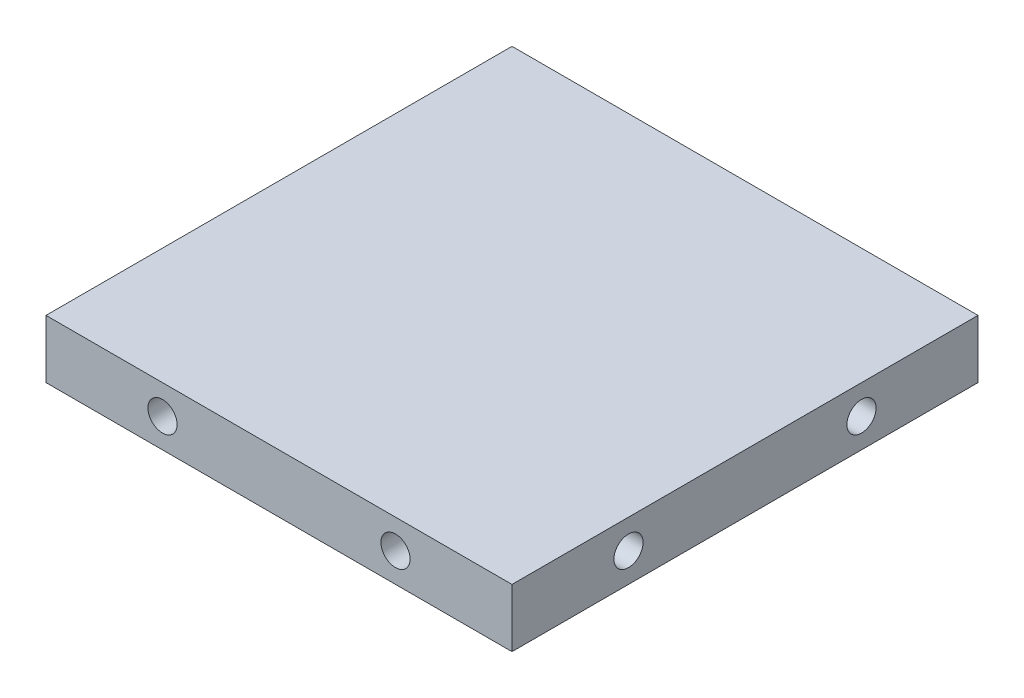
from build123d import *

# Parameters (mm, degrees)
SKETCH1_W           = 40
SKETCH1_H           = 40
BOSS_EXTRUDE1_DEPTH = 5
SKETCH2_R           = 1.25
CUT_EXTRUDE1_DEPTH  = 5
CIRPATTERN1_COUNT   = 4


with BuildPart() as part:
    # Sketch1 → Boss-Extrude1 (new body)
    with BuildSketch(Plane(origin=(0, 0, 0), x_dir=(1, 0, 0), z_dir=(0, 1, 0))):
        Rectangle(SKETCH1_W, SKETCH1_H)
    extrude(amount=BOSS_EXTRUDE1_DEPTH)

    # Sketch2 → Cut-Extrude1 (cut)
    with BuildSketch(Plane.XY.offset(20)):
        with Locations((-10, 2.5)):
            Circle(SKETCH2_R)
        with Locations(Location((10, 2.5, 0), (0, 0, 180))):
            Circle(SKETCH2_R)
    cut_extrude1 = extrude(amount=-CUT_EXTRUDE1_DEPTH, mode=Mode.SUBTRACT)

    # CirPattern1: Cut-Extrude1 ×4 about axis
    cirpattern1_axis = Axis((0, 0, 0), (0, 1, 0))
    for i in range(1, CIRPATTERN1_COUNT):
        add(cut_extrude1.rotate(cirpattern1_axis, i * 360 / CIRPATTERN1_COUNT), mode=Mode.SUBTRACT)


solid = part.part
